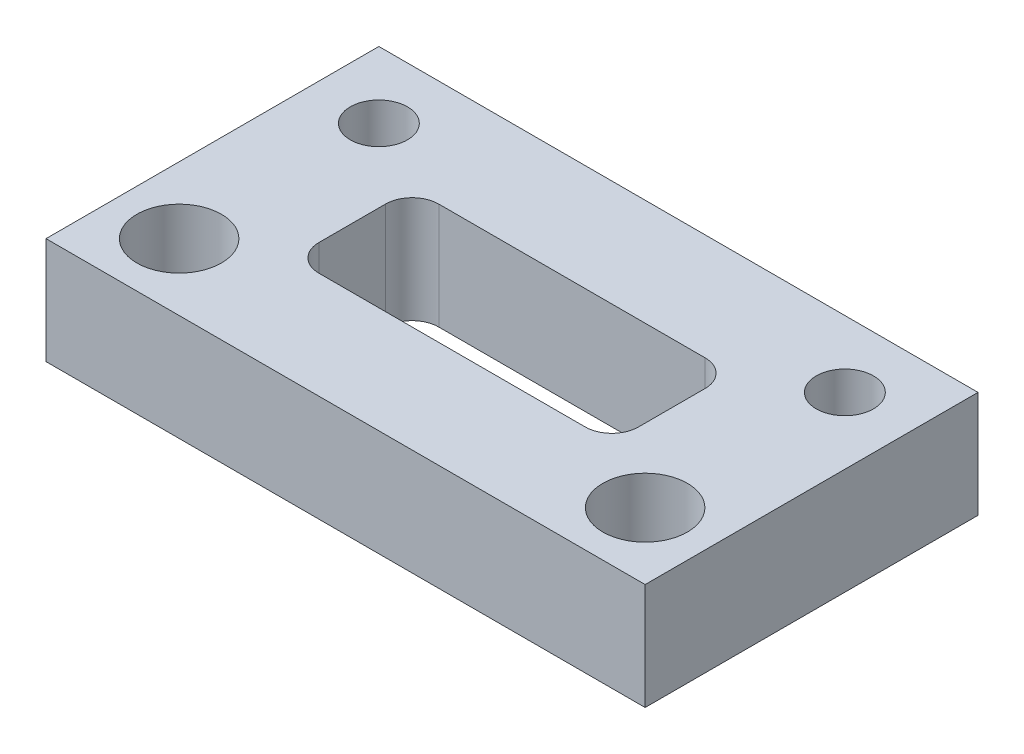
from build123d import *

# Parameters (mm, degrees)
SKETCH_1_W          = 45
SKETCH_1_H          = 25
EXTRUDE_1_DEPTH     = 8
SKETCH_2_R          = 2.15
SKETCH_2_R_2        = 3.175
CUT_EXTRUDE_1_DEPTH = 27.953663944
SKETCH_3_W          = 24
SKETCH_3_H          = 9
CUT_EXTRUDE_2_DEPTH = 27.953663944
FILLET_1_R          = 2


with BuildPart() as part:
    # 草图1 → 凸台-拉伸1 (new body)
    with BuildSketch(Plane(origin=(0, 0, 0), x_dir=(1, 0, 0), z_dir=(0, 1, 0))):
        Rectangle(SKETCH_1_W, SKETCH_1_H)
    extrude(amount=EXTRUDE_1_DEPTH)

    # 草图2 → 切除-拉伸1 (cut, through all)
    with BuildSketch(Plane(origin=(0, 8, 0), x_dir=(1, 0, 0), z_dir=(0, 1, 0))):
        with Locations(Location((-17.5, 7.5, 0), (0, 0, 270))):
            Circle(SKETCH_2_R)
        with Locations(Location((17.5, 7.5, 0), (0, 0, 270))):
            Circle(SKETCH_2_R)
        with Locations(Location((17.5, -7.5, 0), (0, 0, 270))):
            Circle(SKETCH_2_R_2)
        with Locations(Location((-17.5, -7.5, 0), (0, 0, 270))):
            Circle(SKETCH_2_R_2)
    extrude(amount=-CUT_EXTRUDE_1_DEPTH, mode=Mode.SUBTRACT)

    # 草图3 → 切除-拉伸2 (cut, through all)
    with BuildSketch(Plane(origin=(0, 8, 0), x_dir=(1, 0, 0), z_dir=(0, 1, 0))):
        Rectangle(SKETCH_3_W, SKETCH_3_H)
    extrude(amount=-CUT_EXTRUDE_2_DEPTH, mode=Mode.SUBTRACT)

    # 圆角1
    fillet_1_edges = [part.edges().sort_by_distance(p)[0] for p in [
        (-12, 4, 4.5),
        (-12, 4, -4.5),
        (12, 4, -4.5),
        (12, 4, 4.5),
    ]]
    fillet(fillet_1_edges, radius=FILLET_1_R)


solid = part.part
